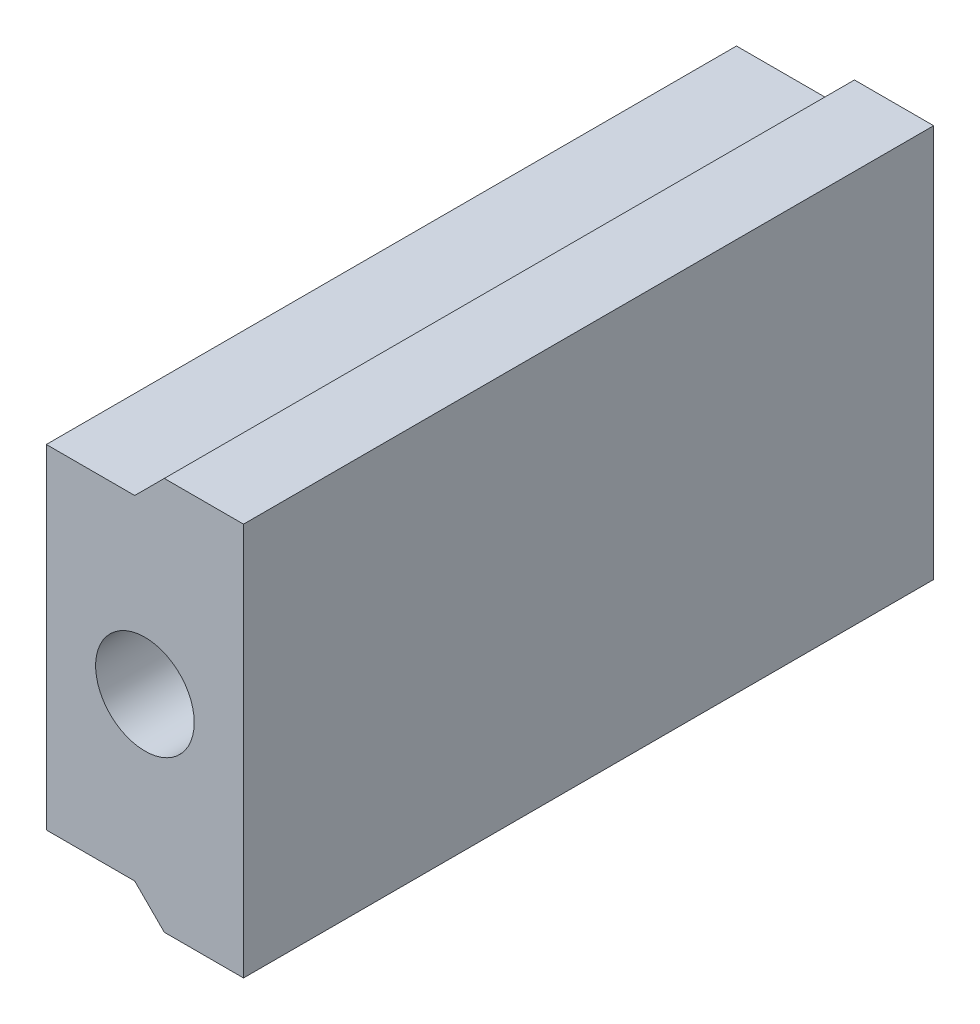
from build123d import *

# Parameters (mm, degrees)
SKETCH_1_W          = 20
SKETCH_1_H          = 39.865713352
EXTRUDE_1_DEPTH     = 70
CUT_EXTRUDE_1_DEPTH = 70
SKETCH_3_R          = 5
CUT_EXTRUDE_2_DEPTH = 74.466446595


with BuildPart() as part:
    # 草图1 → 凸台-拉伸1 (new body)
    with BuildSketch(Plane.XY):
        Rectangle(SKETCH_1_W, SKETCH_1_H)
    extrude(amount=EXTRUDE_1_DEPTH)

    # 草图2 → 切除-拉伸1 (cut)
    with BuildSketch(Plane.XY.offset(70)):
        Polygon((-10, -19.932856676), (1.964722344, -19.932856676), (-1.035277656, -16.932856676), (-10, -16.932856676), align=None)
        Polygon((-10, 19.932856676), (-10, 16.932856676), (-1.035277656, 16.932856676), (1.964722344, 19.932856676), align=None)
    extrude(amount=-CUT_EXTRUDE_1_DEPTH, mode=Mode.SUBTRACT)

    # 草图3 → 切除-拉伸2 (cut, through all)
    with BuildSketch(Plane.XY.offset(70)):
        Circle(SKETCH_3_R)
    extrude(amount=-CUT_EXTRUDE_2_DEPTH, mode=Mode.SUBTRACT)


solid = part.part
